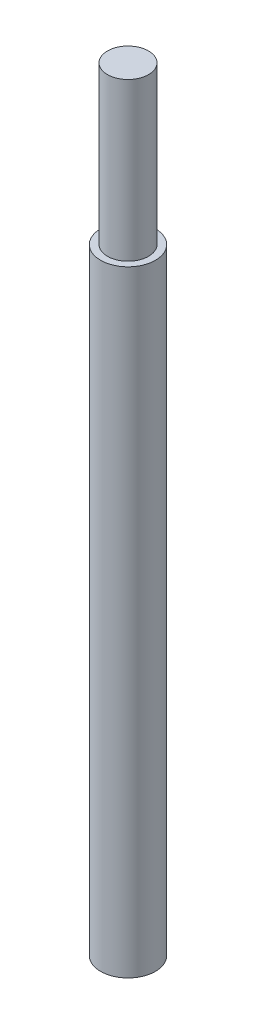
from build123d import *

# Parameters (mm, degrees)
SKETCH1_R           = 4
BOSS_EXTRUDE1_DEPTH = 90
SKETCH2_R           = 3
BOSS_EXTRUDE2_DEPTH = 23


with BuildPart() as part:
    # Sketch1 → Boss-Extrude1 (new body)
    with BuildSketch(Plane(origin=(0, 0, 0), x_dir=(1, 0, 0), z_dir=(0, 1, 0))):
        with Locations(Location((0, 0, 0), (0, 0, 90))):
            Circle(SKETCH1_R)
    extrude(amount=BOSS_EXTRUDE1_DEPTH)

    # Sketch2 → Boss-Extrude2 (add)
    with BuildSketch(Plane(origin=(0, 90, 0), x_dir=(1, 0, 0), z_dir=(0, 1, 0))):
        with Locations(Location((0, 0, 0), (0, 0, 270))):
            Circle(SKETCH2_R)
    extrude(amount=BOSS_EXTRUDE2_DEPTH)


solid = part.part
